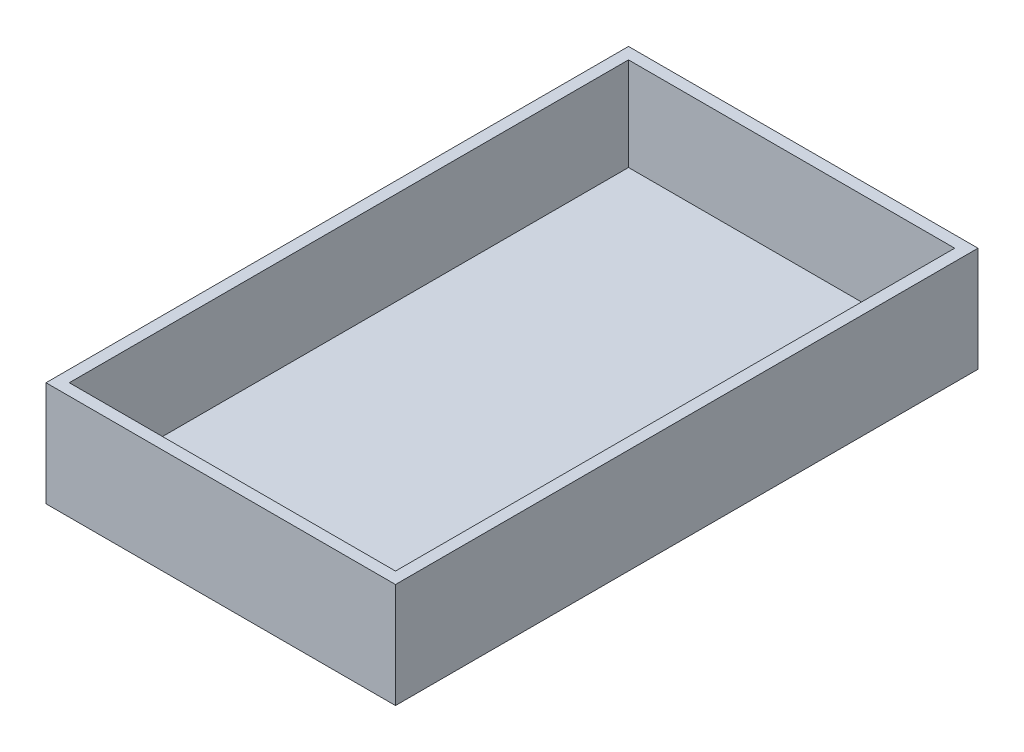
from build123d import *

# Parameters (mm, degrees)
SKETCH1_W           = 300
SKETCH1_H           = 100
BOSS_EXTRUDE1_DEPTH = 500
SHELL2_T            = 10
SKETCH2_W           = 300
SKETCH2_H           = 500
CUT_EXTRUDE1_DEPTH  = 10


with BuildPart() as part:
    # Sketch1 → Boss-Extrude1 (new body)
    with BuildSketch(Plane.XY):
        Rectangle(SKETCH1_W, SKETCH1_H)
    extrude(amount=BOSS_EXTRUDE1_DEPTH)

    # Shell2 (no face opened: a closed hollow body)
    add(offset(amount=-SHELL2_T, mode=Mode.PRIVATE), mode=Mode.SUBTRACT)

    # Sketch2 → Cut-Extrude1 (cut)
    with BuildSketch(Plane(origin=(0, 50, 0), x_dir=(1, 0, 0), z_dir=(0, 1, 0))):
        with Locations((0, -250)):
            Rectangle(SKETCH2_W, SKETCH2_H)
    extrude(amount=-CUT_EXTRUDE1_DEPTH, mode=Mode.SUBTRACT)


solid = part.part
